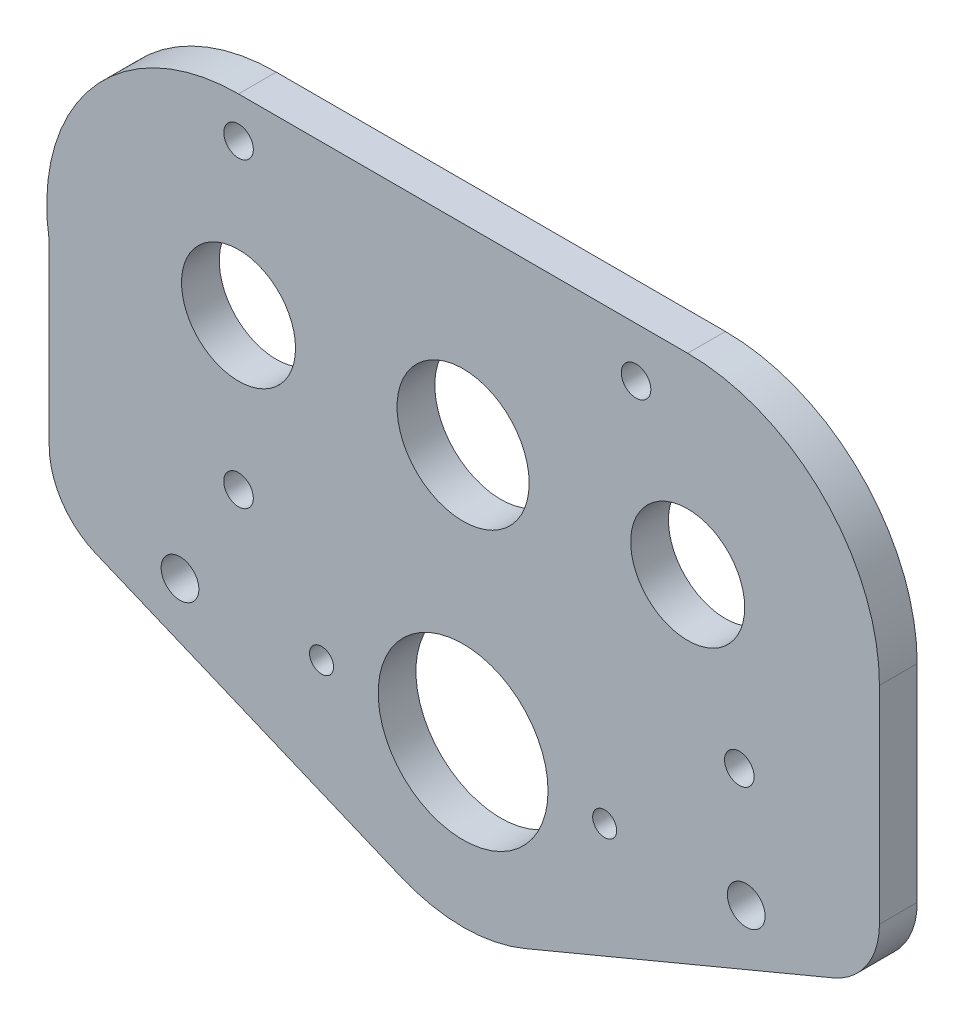
from build123d import *

# Parameters (mm, degrees)
SKETCH1_R           = 14.2875
SKETCH1_R_2         = 9.5885
SKETCH1_R_3         = 11.1125
SKETCH1_R_4         = 3.175
SKETCH1_R_5         = 2.0193
SKETCH1_R_6         = 2.4892
BOSS_EXTRUDE1_DEPTH = 3.175


with BuildPart() as part:
    # Sketch1 → Boss-Extrude1 (new, symmetric)
    with BuildSketch(Plane.XY):
        with BuildLine():
            Line((-37.779325, 75.5142), (37.779325, 75.5142))
            ThreePointArc((37.779325, 75.5142), (60.589175548, 66.066050548), (70.037325, 43.2562))
            Line((70.037325, 43.2562), (70.037325, 8.459528855))
            ThreePointArc((70.037325, 8.459528855), (67.907089191, 1.418926257), (62.231012411, -3.259763936))
            Line((62.231012411, -3.259763936), (10.399085748, -24.903497181))
            ThreePointArc((10.399085748, -24.903497181), (-4.3461e-05, -26.9875), (-10.399165957, -24.903463688))
            Line((-10.399165957, -24.903463688), (-61.816293797, -3.432745712))
            ThreePointArc((-61.816293797, -3.432745712), (-67.49234417, 1.245945741), (-69.622568641, 8.286531317))
            Line((-69.622568641, 8.286531317), (-69.622568641, 38.1))
            ThreePointArc((-69.622568641, 38.1), (-62.344618237, 64.163732906), (-37.779325, 75.5142))
        make_face()
        Circle(SKETCH1_R, mode=Mode.SUBTRACT)
        with Locations((-37.779325, 43.2562)):
            Circle(SKETCH1_R_2, mode=Mode.SUBTRACT)
        with Locations((37.779325, 43.2562)):
            Circle(SKETCH1_R_2, mode=Mode.SUBTRACT)
        with Locations((0, 43.2562)):
            Circle(SKETCH1_R_3, mode=Mode.SUBTRACT)
        with Locations((-47.625, 0)):
            Circle(SKETCH1_R_4, mode=Mode.SUBTRACT)
        with Locations((47.625, 0)):
            Circle(SKETCH1_R_4, mode=Mode.SUBTRACT)
        with Locations((-23.8125, 0)):
            Circle(SKETCH1_R_5, mode=Mode.SUBTRACT)
        with Locations((23.8125, 0)):
            Circle(SKETCH1_R_5, mode=Mode.SUBTRACT)
        with Locations((-37.779325, 68.6562)):
            Circle(SKETCH1_R_6, mode=Mode.SUBTRACT)
        with Locations((-37.779325, 17.8562)):
            Circle(SKETCH1_R_6, mode=Mode.SUBTRACT)
        with Locations((46.46663664, 19.388007432)):
            Circle(SKETCH1_R_6, mode=Mode.SUBTRACT)
        with Locations((29.09201336, 67.124392568)):
            Circle(SKETCH1_R_6, mode=Mode.SUBTRACT)
    extrude(amount=BOSS_EXTRUDE1_DEPTH, both=True)


solid = part.part
